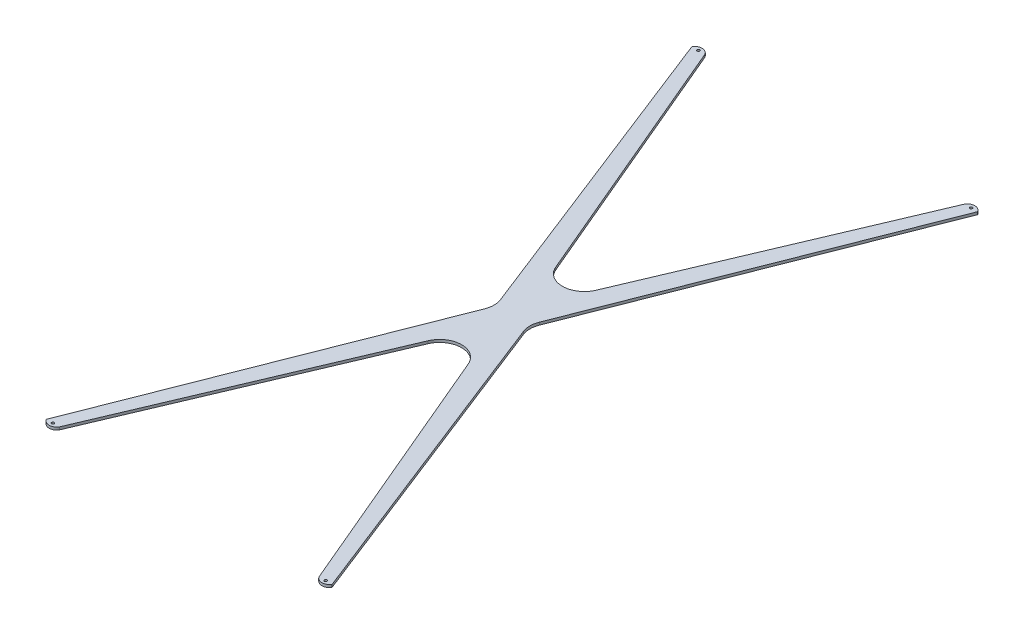
from build123d import *

# Parameters (mm, degrees)
SKETCH1_R           = 6
BOSS_EXTRUDE1_DEPTH = 12
FILLET1_R           = 100


with BuildPart() as part:
    # Sketch1 → Boss-Extrude1 (new body)
    with BuildSketch(Plane(origin=(0, 0, 0), x_dir=(1, 0, 0), z_dir=(0, 1, 0))):
        with BuildLine():
            Line((550, 1479.5), (-30, 2959))
            ThreePointArc((-30, 2959), (0, 2976), (30, 2959))
            Line((30, 2959), (625, 1554.5))
            Line((625, 1554.5), (1220, 2959))
            ThreePointArc((1220, 2959), (1250, 2976), (1280, 2959))
            Line((1280, 2959), (700, 1479.5))
            Line((700, 1479.5), (1280, 0))
            ThreePointArc((1280, 0), (1250, -17), (1220, 0))
            Line((1220, 0), (625, 1404.5))
            Line((625, 1404.5), (30, 0))
            ThreePointArc((30, 0), (0, -17), (-30, 0))
            Line((-30, 0), (550, 1479.5))
        make_face()
        with Locations(Location((0, 2959, 0), (0, 0, 270))):
            Circle(SKETCH1_R, mode=Mode.SUBTRACT)
        with Locations(Location((1250, 2959, 0), (0, 0, 270))):
            Circle(SKETCH1_R, mode=Mode.SUBTRACT)
        with Locations(Location((1250, 0, 0), (0, 0, 270))):
            Circle(SKETCH1_R, mode=Mode.SUBTRACT)
        with Locations(Location((0, 0, 0), (0, 0, 270))):
            Circle(SKETCH1_R, mode=Mode.SUBTRACT)
    extrude(amount=BOSS_EXTRUDE1_DEPTH)

    # Fillet1
    fillet1_edges = [part.edges().sort_by_distance(p)[0] for p in [
        (625, 6, -1554.5),
        (700, 6, -1479.5),
        (625, 6, -1404.5),
        (550, 6, -1479.5),
    ]]
    fillet(fillet1_edges, radius=FILLET1_R)


solid = part.part
